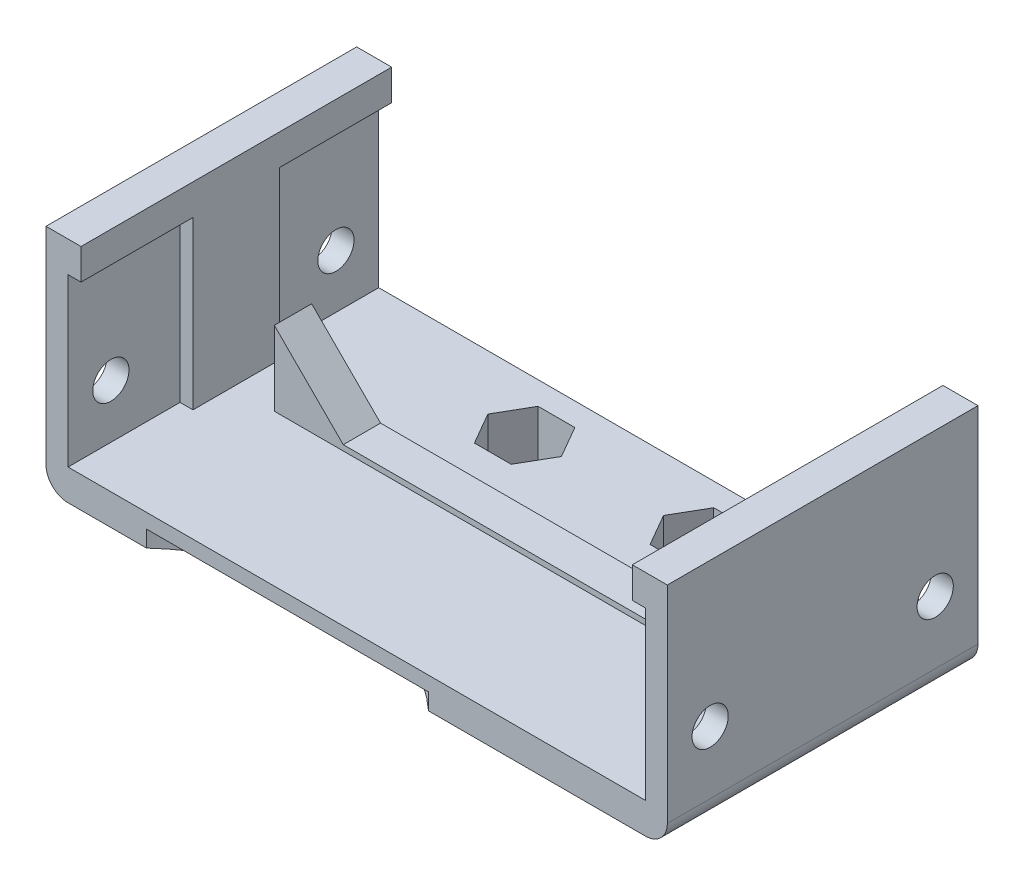
from build123d import *

# Parameters (mm, degrees)
BOSS_EXTRUDE1_DEPTH = 28.3
SKETCH2_W           = 52.58
SKETCH2_H           = 15.18
CUT_EXTRUDE1_DEPTH  = 10.2
CUT_EXTRUDE2_START  = 28.3
SKETCH2_2_W         = 52.58
SKETCH2_2_H         = 15.18
CUT_EXTRUDE2_DEPTH  = 10.2
CUT_EXTRUDE3_REACH  = 68.615
SKETCH3_R           = 1.65
BOSS_EXTRUDE2_START = 11.1
BOSS_EXTRUDE2_DEPTH = 3.4
CUT_EXTRUDE4_DEPTH  = 1.5
SKETCH6_R           = 1.65
BOSS_EXTRUDE3_DEPTH = 6
CUT_EXTRUDE5_START  = -8.82
CUT_EXTRUDE5_DEPTH  = 5.82


with BuildPart() as part:
    # Sketch1 → Boss-Extrude1 (new body)
    with BuildSketch(Plane.XY):
        with BuildLine():
            Line((0, 20.81), (3.19, 20.81))
            Line((3.19, 20.81), (3.19, 2.82))
            Line((3.19, 2.82), (53.41, 2.82))
            Line((53.41, 2.82), (53.41, 20.81))
            Line((53.41, 20.81), (56.6, 20.81))
            Line((56.6, 20.81), (56.6, 2))
            ThreePointArc((56.6, 2), (56.014213562, 0.585786438), (54.6, 0))
            Line((54.6, 0), (2, 0))
            ThreePointArc((2, 0), (0.585786438, 0.585786438), (0, 2))
            Line((0, 2), (0, 20.81))
        make_face()
    extrude(amount=BOSS_EXTRUDE1_DEPTH)

    # Sketch2 → Cut-Extrude1 (cut)
    with BuildSketch(Plane.XY):
        with Locations((28.3, 10.41)):
            Rectangle(SKETCH2_W, SKETCH2_H)
    extrude(amount=CUT_EXTRUDE1_DEPTH, mode=Mode.SUBTRACT)

    # Sketch2<2> → Cut-Extrude2 (cut)
    with BuildSketch(Plane.XY.offset(CUT_EXTRUDE2_START)):
        with Locations((28.3, 10.41)):
            Rectangle(SKETCH2_2_W, SKETCH2_2_H)
    extrude(amount=-CUT_EXTRUDE2_DEPTH, mode=Mode.SUBTRACT)

    # Cut-Extrude3: up to this face of the body (flat: up to its plane)
    cut_extrude3_end = Plane(part.part.faces().sort_by_distance((56.6, 11.405, 14.15))[0])
    # Sketch3 → Cut-Extrude3 (cut, up to the picked face)
    with BuildSketch(Plane.ZY, mode=Mode.PRIVATE) as cut_extrude3_sk1:
        with Locations((3.9, 7.71)):
            Circle(SKETCH3_R)
    cut_extrude3_tool1 = split(extrude(cut_extrude3_sk1.sketch, amount=-CUT_EXTRUDE3_REACH, mode=Mode.PRIVATE), bisect_by=cut_extrude3_end, keep=Keep.BOTH, mode=Mode.PRIVATE)
    # Sketch3 → Cut-Extrude3 (cut, up to the picked face)
    with BuildSketch(Plane.ZY, mode=Mode.PRIVATE) as cut_extrude3_sk2:
        with Locations((24.4, 7.71)):
            Circle(SKETCH3_R)
    cut_extrude3_tool2 = split(extrude(cut_extrude3_sk2.sketch, amount=-CUT_EXTRUDE3_REACH, mode=Mode.PRIVATE), bisect_by=cut_extrude3_end, keep=Keep.BOTH, mode=Mode.PRIVATE)
    add(cut_extrude3_tool1.solids().sort_by(Axis((0, 7.71, 3.9), (1, 0, 0)))[0], mode=Mode.SUBTRACT)
    add(cut_extrude3_tool2.solids().sort_by(Axis((0, 7.71, 24.4), (1, 0, 0)))[0], mode=Mode.SUBTRACT)

    # Sketch4 → Boss-Extrude2 (add)
    with BuildSketch(Plane.XY.offset(BOSS_EXTRUDE2_START)):
        Polygon((7, 9.598174593), (13.278174593, 3.32), (43.321825407, 3.32), (49.6, 9.598174593), (49.6, 2.82), (7, 2.82), align=None)
    extrude(amount=BOSS_EXTRUDE2_DEPTH)

    # Sketch5 → Cut-Extrude4 (cut)
    with BuildSketch(Plane.XZ):
        with BuildLine():
            Line((34.845232579, 28.3), (9.154767421, 28.3))
            ThreePointArc((9.154767421, 28.3), (22, 23.3), (34.845232579, 28.3))
        make_face()
    extrude(amount=-CUT_EXTRUDE4_DEPTH, mode=Mode.SUBTRACT)

    # Sketch6 → Boss-Extrude3 (add)
    # profile 1 of 2: a face of its own
    with BuildSketch(Plane.XZ):
        Polygon((26.073502692, 5), (23.186751346, 10), (17.413248654, 10), (14.526497308, 5), (17.413248654, 0), (23.186751346, 0), align=None)
        with Locations(Location((20.3, 5, 0), (0, 0, 270))):
            Circle(SKETCH6_R, mode=Mode.SUBTRACT)
    # profile 2 of 2: a face of its own
    with BuildSketch(Plane.XZ):
        Polygon((42.073502692, 5), (39.186751346, 10), (33.413248654, 10), (30.526497308, 5), (33.413248654, 0), (39.186751346, 0), align=None)
        with Locations(Location((36.3, 5, 0), (0, 0, 270))):
            Circle(SKETCH6_R, mode=Mode.SUBTRACT)
    extrude(amount=BOSS_EXTRUDE3_DEPTH)

    # Sketch8 → Cut-Extrude5 (cut)
    with BuildSketch(Plane.XZ.offset(6).offset(CUT_EXTRUDE5_START)):
        Polygon((23.648631561, 5), (21.974315781, 7.9), (18.625684219, 7.9), (16.951368439, 5), (18.625684219, 2.1), (21.974315781, 2.1), align=None)
        Polygon((39.648631561, 5), (37.974315781, 7.9), (34.625684219, 7.9), (32.951368439, 5), (34.625684219, 2.1), (37.974315781, 2.1), align=None)
    extrude(amount=CUT_EXTRUDE5_DEPTH, mode=Mode.SUBTRACT)


solid = part.part
